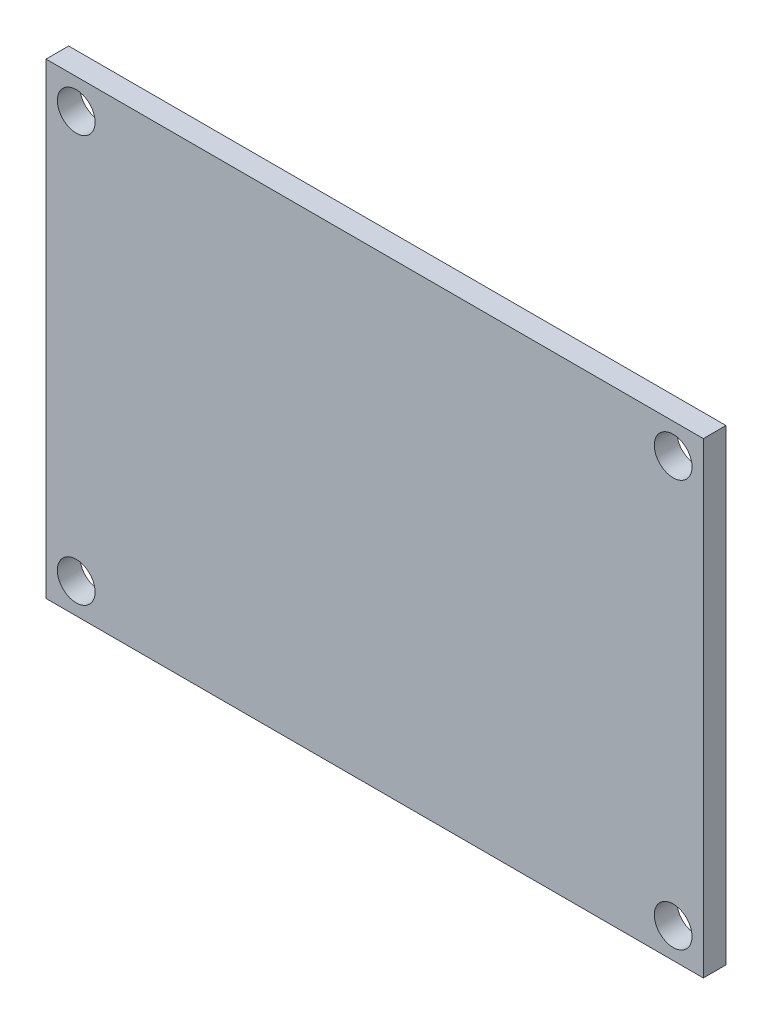
from build123d import *

# Parameters (mm, degrees)
SKETCH_1_W          = 87.1
SKETCH_1_H          = 61.9
EXTRUDE_1_DEPTH     = 3
SKETCH_2_R          = 2.5
CUT_EXTRUDE_1_DEPTH = 54.511727687


with BuildPart() as part:
    # 草图1 → 凸台-拉伸1 (new body)
    with BuildSketch(Plane.XY):
        Rectangle(SKETCH_1_W, SKETCH_1_H)
    extrude(amount=EXTRUDE_1_DEPTH)

    # 草图2 → 切除-拉伸1 (cut, through all)
    with BuildSketch(Plane(origin=(0, 0, 0), x_dir=(-1, 0, 0), z_dir=(0, 0, -1))):
        with Locations((-39.55, 26.95)):
            Circle(SKETCH_2_R)
        with Locations((-39.55, -26.95)):
            Circle(SKETCH_2_R)
        with Locations((39.55, -26.95)):
            Circle(SKETCH_2_R)
        with Locations((39.55, 26.95)):
            Circle(SKETCH_2_R)
    extrude(amount=-CUT_EXTRUDE_1_DEPTH, mode=Mode.SUBTRACT)


solid = part.part
